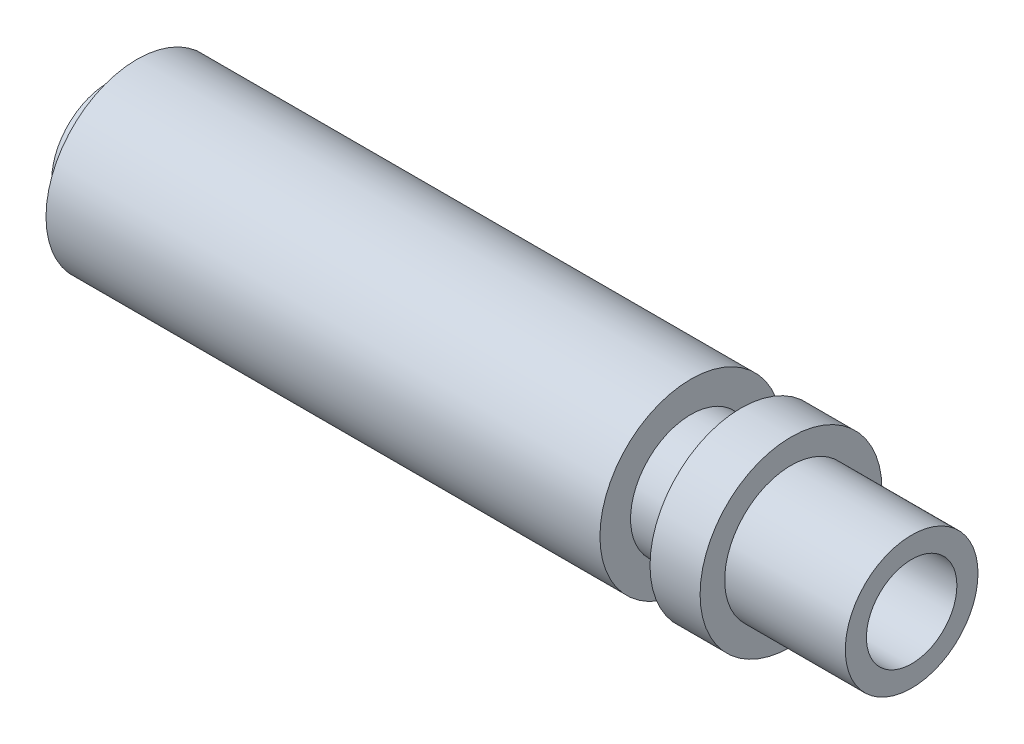
from build123d import *

# Parameters (mm, degrees)
SKETCH1_R           = 15.07617
BOSS_EXTRUDE1_DEPTH = 108.4446395
SKETCH2_R           = 9.3853
SKETCH2_R_2         = 4.5847
BOSS_EXTRUDE2_DEPTH = 4.7498
SKETCH3_R           = 7.5
CUT_EXTRUDE1_DEPTH  = 18.75
BOSS_EXTRUDE3_START = 20
SKETCH4_R           = 11
SKETCH4_R_2         = 7.5
BOSS_EXTRUDE3_DEPTH = 20
CUT_EXTRUDE4_START  = -8.3023864
SKETCH5_R           = 15.07617
SKETCH5_R_2         = 10
CUT_EXTRUDE4_DEPTH  = 8.3023864


with BuildPart() as part:
    # Sketch1 → Boss-Extrude1 (new body)
    with BuildSketch(Plane(origin=(0, 0, 0), x_dir=(0, 0, -1), z_dir=(1, 0, 0))):
        Circle(SKETCH1_R)
    extrude(amount=BOSS_EXTRUDE1_DEPTH)

    # Sketch2 → Boss-Extrude2 (add)
    with BuildSketch(Plane.ZY):
        with Locations(Location((0, 0, 0), (0, 0, 180))):
            Circle(SKETCH2_R)
        Circle(SKETCH2_R_2, mode=Mode.SUBTRACT)
    extrude(amount=BOSS_EXTRUDE2_DEPTH)

    # Sketch3 → Cut-Extrude1 (cut)
    with BuildSketch(Plane(origin=(108.4446395, 0, 0), x_dir=(0, 0, -1), z_dir=(1, 0, 0))):
        Circle(SKETCH3_R)
    extrude(amount=-CUT_EXTRUDE1_DEPTH, mode=Mode.SUBTRACT)

    # Sketch4 → Boss-Extrude3 (add)
    with BuildSketch(Plane(origin=(108.4446395, 0, 0), x_dir=(0, 0, -1), z_dir=(1, 0, 0)).offset(BOSS_EXTRUDE3_START)):
        Circle(SKETCH4_R)
        Circle(SKETCH4_R_2, mode=Mode.SUBTRACT)
    extrude(amount=-BOSS_EXTRUDE3_DEPTH)

    # Sketch5 → Cut-Extrude4 (cut)
    with BuildSketch(Plane(origin=(100.1422531, 0, 0), x_dir=(0, 0, -1), z_dir=(1, 0, 0)).offset(CUT_EXTRUDE4_START)):
        Circle(SKETCH5_R)
        Circle(SKETCH5_R_2, mode=Mode.SUBTRACT)
    extrude(amount=CUT_EXTRUDE4_DEPTH, mode=Mode.SUBTRACT)


solid = part.part
